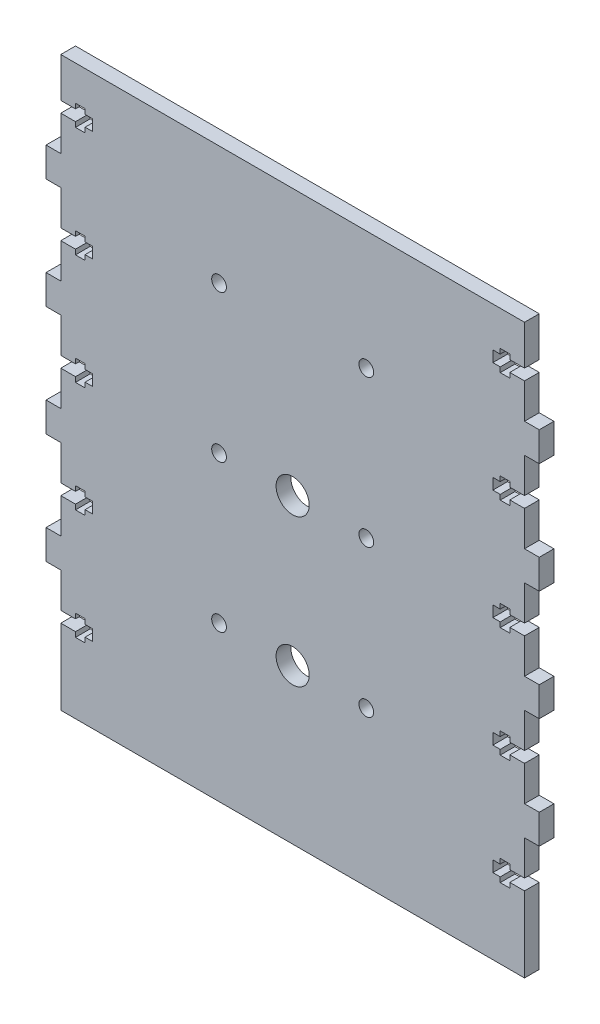
from build123d import *

# Parameters (mm, degrees)
SKETCH_1_R          = 2
EXTRUDE_1_DEPTH     = 4
SKETCH_3_W          = 126
SKETCH_3_H          = 2.7
CUT_EXTRUDE_1_DEPTH = 10
SKETCH_4_R          = 4.5
SKETCH_4_R_2        = 2
CUT_EXTRUDE_2_DEPTH = 10


with BuildPart() as part:
    # 草图1 → 凸台-拉伸1 (new body)
    with BuildSketch(Plane.XY):
        Polygon((145, 46.5), (149, 46.5), (149, 45.15), (151.6, 45.15), (151.6, 46.5), (153.6, 46.5), (153.6, 49.5), (151.6, 49.5), (151.6, 50.85), (149, 50.85), (149, 49.5), (145, 49.5), (145, 59), (141, 59), (141, 67), (145, 67), (145, 76.5), (149, 76.5), (149, 75.15), (151.6, 75.15), (151.6, 76.5), (153.6, 76.5), (153.6, 79.5), (151.6, 79.5), (151.6, 80.85), (149, 80.85), (149, 79.5), (145, 79.5), (145, 89), (141, 89), (141, 97), (145, 97), (145, 106.5), (149, 106.5), (149, 105.15), (151.6, 105.15), (151.6, 106.5), (153.6, 106.5), (153.6, 109.5), (151.6, 109.5), (151.6, 110.85), (149, 110.85), (149, 109.5), (145, 109.5), (145, 123), (271, 123), (271, 109.5), (267, 109.5), (267, 110.85), (264.4, 110.85), (264.4, 109.5), (262.4, 109.5), (262.4, 106.5), (264.4, 106.5), (264.4, 105.15), (267, 105.15), (267, 106.5), (271, 106.5), (271, 97), (275, 97), (275, 89), (271, 89), (271, 79.5), (267, 79.5), (267, 80.85), (264.4, 80.85), (264.4, 79.5), (262.4, 79.5), (262.4, 76.5), (264.4, 76.5), (264.4, 75.15), (267, 75.15), (267, 76.5), (271, 76.5), (271, 67), (275, 67), (275, 59), (271, 59), (271, 49.5), (267, 49.5), (267, 50.85), (264.4, 50.85), (264.4, 49.5), (262.4, 49.5), (262.4, 46.5), (264.4, 46.5), (264.4, 45.15), (267, 45.15), (267, 46.5), (271, 46.5), (271, 37), (275, 37), (275, 29), (271, 29), (271, 19.5), (267, 19.5), (267, 20.85), (264.4, 20.85), (264.4, 19.5), (262.4, 19.5), (262.4, 16.5), (264.4, 16.5), (264.4, 15.15), (267, 15.15), (267, 16.5), (271, 16.5), (271, 7), (275, 7), (275, -1), (271, -1), (271, -10.5), (267, -10.5), (267, -9.15), (264.4, -9.15), (264.4, -10.5), (262.4, -10.5), (262.4, -13.5), (264.4, -13.5), (264.4, -14.85), (267, -14.85), (267, -13.5), (271, -13.5), (271, -27), (271, -34), (145, -34), (145, -27), (145, -13.5), (149, -13.5), (149, -14.85), (151.6, -14.85), (151.6, -13.5), (153.6, -13.5), (153.6, -10.5), (151.6, -10.5), (151.6, -9.15), (149, -9.15), (149, -10.5), (145, -10.5), (145, -1), (141, -1), (141, 7), (145, 7), (145, 16.5), (149, 16.5), (149, 15.15), (151.6, 15.15), (151.6, 16.5), (153.6, 16.5), (153.6, 19.5), (151.6, 19.5), (151.6, 20.85), (149, 20.85), (149, 19.5), (145, 19.5), (145, 29), (141, 29), (141, 37), (145, 37), align=None)
        with Locations((188, 8)):
            Circle(SKETCH_1_R, mode=Mode.SUBTRACT)
        with Locations((228, 8)):
            Circle(SKETCH_1_R, mode=Mode.SUBTRACT)
        with Locations((228, 88)):
            Circle(SKETCH_1_R, mode=Mode.SUBTRACT)
        with Locations((188, 88)):
            Circle(SKETCH_1_R, mode=Mode.SUBTRACT)
    extrude(amount=EXTRUDE_1_DEPTH)

    # 草图3 → 切除-拉伸1 (cut)
    with BuildSketch(Plane.XY.offset(4)):
        with Locations((208, 121.65)):
            Rectangle(SKETCH_3_W, SKETCH_3_H)
    extrude(amount=-CUT_EXTRUDE_1_DEPTH, mode=Mode.SUBTRACT)

    # 草图4 → 切除-拉伸2 (cut)
    with BuildSketch(Plane.XY.offset(4)):
        with Locations((208, 8)):
            Circle(SKETCH_4_R)
        with Locations((228, 48)):
            Circle(SKETCH_4_R_2)
        with Locations((188, 48)):
            Circle(SKETCH_4_R_2)
        with Locations((208, 48)):
            Circle(SKETCH_4_R)
    extrude(amount=-CUT_EXTRUDE_2_DEPTH, mode=Mode.SUBTRACT)


solid = part.part
